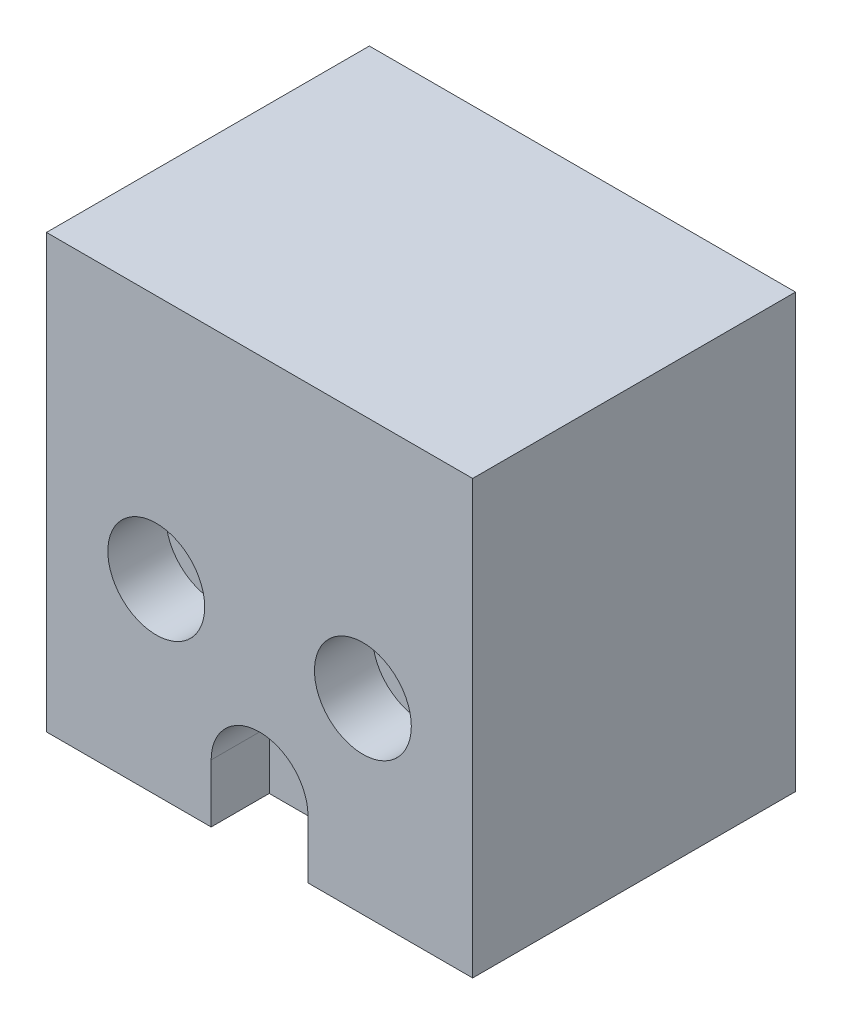
from build123d import *

# Parameters (mm, degrees)
BASE_SKETCH_W   = 33
BASE_SKETCH_H   = 33.5
BASE_DEPTH      = 25
DRILL_SKETCH_R  = 2.25
DRILL_DEPTH     = 45.938847337
MILL_START      = -4.5
MILL_SKETCH_W   = 7.5
MILL_SKETCH_H   = 4.5
MILL_DEPTH      = 4.5
C_BORE_START    = -4.5
C_BORE_SKETCH_R = 3.75
C_BORE_DEPTH    = 4.5


with BuildPart() as part:
    # Base_Sketch → Base (new body)
    with BuildSketch(Plane.XY):
        with Locations((0, 16.75)):
            Rectangle(BASE_SKETCH_W, BASE_SKETCH_H)
    extrude(amount=-BASE_DEPTH)

    # Drill_Sketch → Drill (cut, through all)
    with BuildSketch(Plane.XY):
        with Locations((0, 4.5)):
            Circle(DRILL_SKETCH_R)
        with Locations((-8, 14.5)):
            Circle(DRILL_SKETCH_R)
        with Locations((8, 14.5)):
            Circle(DRILL_SKETCH_R)
    extrude(amount=-DRILL_DEPTH, mode=Mode.SUBTRACT)

    # Mill_Sketch → Mill (cut)
    with BuildSketch(Plane.XY.offset(MILL_START)):
        with Locations((0, 2.25)):
            Rectangle(MILL_SKETCH_W, MILL_SKETCH_H)
    extrude(amount=MILL_DEPTH, mode=Mode.SUBTRACT)

    # C_Bore_Sketch → C_Bore (cut)
    with BuildSketch(Plane.XY.offset(C_BORE_START)):
        with Locations((-8, 14.5)):
            Circle(C_BORE_SKETCH_R)
        with Locations((8, 14.5)):
            Circle(C_BORE_SKETCH_R)
        with Locations((0, 4.5)):
            Circle(C_BORE_SKETCH_R)
    extrude(amount=C_BORE_DEPTH, mode=Mode.SUBTRACT)


solid = part.part
